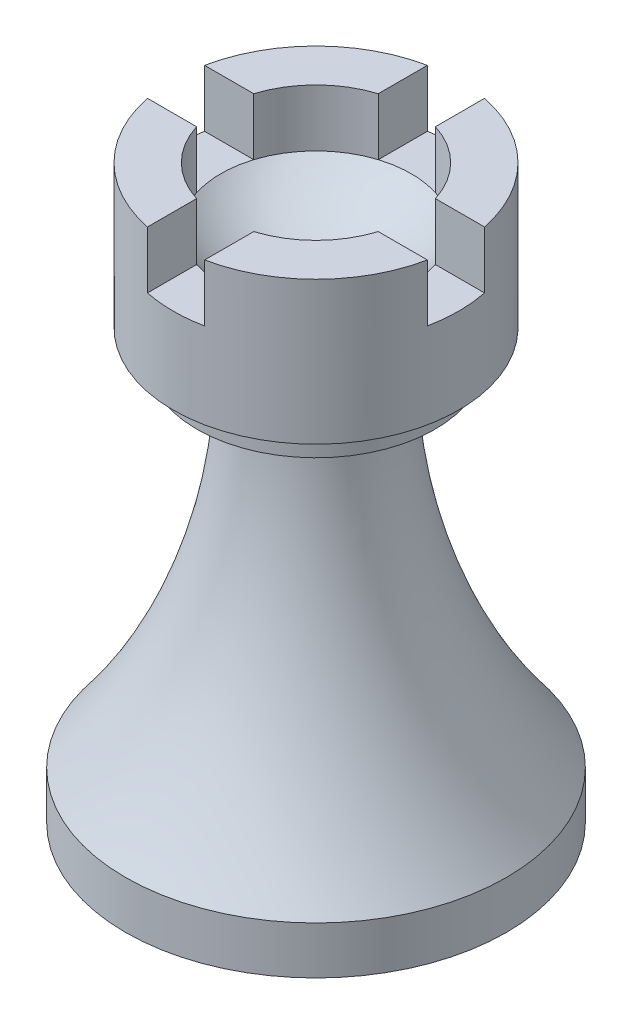
from build123d import *

# Parameters (mm, degrees)
FILLET1_R               = 2
CUT_EXTRUDE1_REACH      = 52.636
CUT_EXTRUDE1_END_RADIUS = 15
SKETCH2_W               = 6
SKETCH2_H               = 12
CIRPATTERN1_COUNT       = 4
SCALE_1_SCALE           = 0.6


with BuildPart() as part:
    # Sketch1 → Revolve1 (revolve)
    with BuildSketch(Plane.XY, mode=Mode.PRIVATE) as revolve1_sk:
        with BuildLine():
            Line((20, -37), (20, -42))
            Line((20, -42), (0, -42))
            Line((0, -42), (0, 0))
            Line((0, 0), (0, 8))
            ThreePointArc((0, 8), (5.346686076, 9.133284811), (10, 12))
            Line((10, 12), (10, 18))
            Line((10, 18), (15, 18))
            Line((15, 18), (15, 3))
            Line((15, 3), (12.5, 3))
            Line((12.5, 3), (12.5, 0))
            Line((12.5, 0), (7.5, 0))
            ThreePointArc((7.5, 0), (10.655312326, -19.545502593), (20, -37))
        make_face()
    revolve(revolve1_sk.sketch.rotate(Axis((0, 46.622291022, 0), (0, -1, 0)), 90), axis=Axis((0, 46.622291022, 0), (0, -1, 0)))

    # Fillet1
    fillet1_edges = [part.edges().sort_by_distance(p)[0] for p in [
        (0, 0, -7.5),
    ]]
    fillet(fillet1_edges, radius=FILLET1_R)

    # Cut-Extrude1: up to this cylinder (the profile starts inside it)
    cut_extrude1_end = Plane(origin=(0, 18, 0), z_dir=(0, 1, 0)) * Cylinder(CUT_EXTRUDE1_END_RADIUS, 136.272, mode=Mode.PRIVATE)
    # Sketch2 → Cut-Extrude1 (cut, up to the surface)
    with BuildSketch(Plane.XY, mode=Mode.PRIVATE) as cut_extrude1_sk1:
        with Locations((0, 18)):
            Rectangle(SKETCH2_W, SKETCH2_H)
    cut_extrude1_tool1 = extrude(cut_extrude1_sk1.sketch, amount=-CUT_EXTRUDE1_REACH, mode=Mode.PRIVATE) & cut_extrude1_end
    cut_extrude1 = cut_extrude1_tool1.solids().sort_by_distance((0, 18, 0))[0]
    add(cut_extrude1, mode=Mode.SUBTRACT)

    # CirPattern1: Cut-Extrude1 ×4 about axis
    cirpattern1_axis = Axis((0, 0, 0), (0, 1, 0))
    for i in range(1, CIRPATTERN1_COUNT):
        add(cut_extrude1.rotate(cirpattern1_axis, i * 360 / CIRPATTERN1_COUNT), mode=Mode.SUBTRACT)


with BuildPart() as part_1:
    # 缩放比例1: scaled about (0, 0, 0)
    add(part.part.scale(SCALE_1_SCALE))


solid = part_1.part
